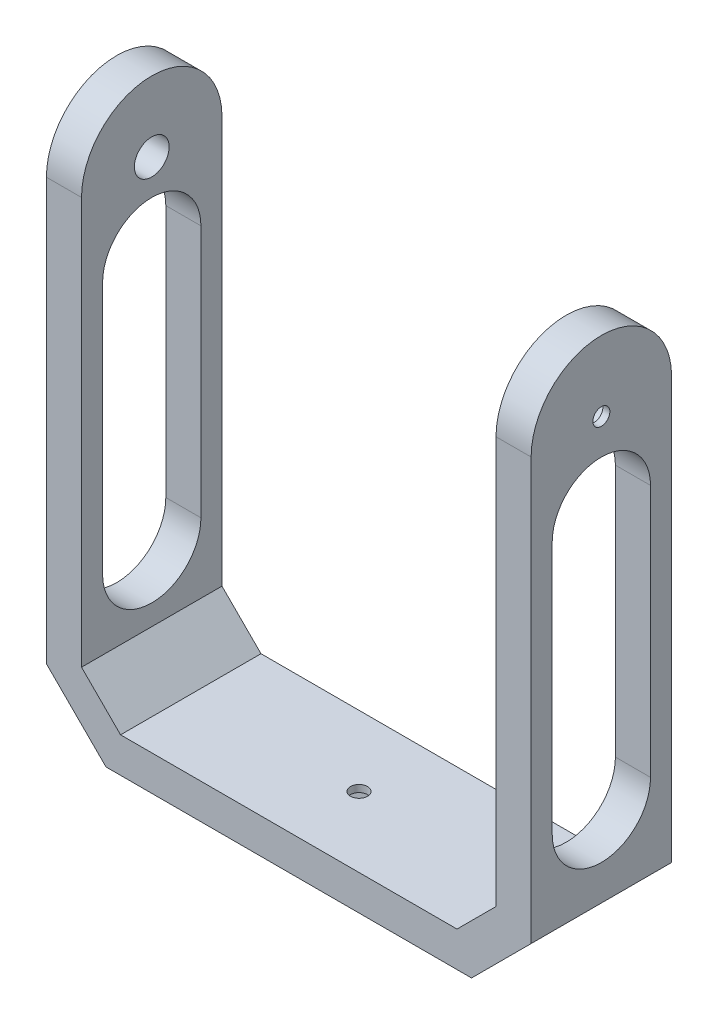
from build123d import *

# Parameters (mm, degrees)
BOSS_EXTRUDE1_DEPTH = 20
FILLET2_RADIUS      = 10
FILLET2_LENGTH      = 5
FILLET3_RADIUS      = 10
FILLET3_LENGTH      = 5
SKETCH2_W           = 36
SKETCH2_H           = 7.55
CUT_EXTRUDE1_DEPTH  = 3
CUT_EXTRUDE2_REACH  = 87.375
SKETCH4_R           = 1.21
SKETCH6_W           = 10
SKETCH6_H           = 7.55
CUT_EXTRUDE3_DEPTH  = 1
SKETCH7_R           = 2.45
CUT_EXTRUDE4_DEPTH  = 4
CUT_EXTRUDE5_REACH  = 105.925
SKETCH9_R           = 1.21
SKETCH10_R          = 2.475
CUT_EXTRUDE6_DEPTH  = 4
CUT_EXTRUDE7_DEPTH  = 105.582615121


with BuildPart() as part:
    # Sketch1 → Boss-Extrude1 (new body)
    with BuildSketch(Plane.XY):
        Polygon((-26.024718626, -2.5), (26.024718626, -2.5), (34.51, 5.985281374), (34.51, 75.985281374), (29.51, 75.985281374), (29.51, 8.056349186), (23.953650814, 2.5), (-23.953650814, 2.5), (-29.51, 8.056349186), (-29.51, 75.985281374), (-34.51, 75.985281374), (-34.51, 5.985281374), align=None)
    extrude(amount=BOSS_EXTRUDE1_DEPTH)

    # Fillet2: full round fillet: the end face becomes a half cylinder, R = half its width
    fillet2_face = Plane((-32.01, 75.985281374, 10), x_dir=(-1, 0, 0), z_dir=(0, 1, 0))  # on the end face: x along it, z out of the body
    fillet2_slab = fillet2_face.offset(-FILLET2_RADIUS / 2) * Box(FILLET2_LENGTH, 2 * FILLET2_RADIUS, FILLET2_RADIUS, mode=Mode.PRIVATE)  # the body's end, R deep
    fillet2_round = Plane((-32.01, 65.985281374, 10), x_dir=(0, 1, 0), z_dir=(-1, 0, 0)) * Cylinder(FILLET2_RADIUS, FILLET2_LENGTH, mode=Mode.PRIVATE)  # its axis R under the face
    add(fillet2_slab - fillet2_round, mode=Mode.SUBTRACT)

    # Fillet3: full round fillet: the end face becomes a half cylinder, R = half its width
    fillet3_face = Plane((32.01, 75.985281374, 10), x_dir=(1, 0, 0), z_dir=(0, 1, 0))  # on the end face: x along it, z out of the body
    fillet3_slab = fillet3_face.offset(-FILLET3_RADIUS / 2) * Box(FILLET3_LENGTH, 2 * FILLET3_RADIUS, FILLET3_RADIUS, mode=Mode.PRIVATE)  # the body's end, R deep
    fillet3_round = Plane((32.01, 65.985281374, 10), x_dir=(0, 1, 0), z_dir=(1, 0, 0)) * Cylinder(FILLET3_RADIUS, FILLET3_LENGTH, mode=Mode.PRIVATE)  # its axis R under the face
    add(fillet3_slab - fillet3_round, mode=Mode.SUBTRACT)

    # Sketch2 → Cut-Extrude1 (cut)
    with BuildSketch(Plane.XZ.offset(2.5)):
        with Locations((0, 10)):
            Rectangle(SKETCH2_W, SKETCH2_H)
    extrude(amount=-CUT_EXTRUDE1_DEPTH, mode=Mode.SUBTRACT)

    # Sketch4 → Cut-Extrude2 (cut, up to next)
    with BuildSketch(Plane.XZ.offset(-0.5), mode=Mode.PRIVATE) as cut_extrude2_sk1:
        with Locations(Location((0, 10, 0), (0, 0, 270))):
            Circle(SKETCH4_R)
    cut_extrude2_tool1 = extrude(cut_extrude2_sk1.sketch, amount=-CUT_EXTRUDE2_REACH, mode=Mode.PRIVATE) & part.part
    add(cut_extrude2_tool1.solids().sort_by_distance((0, 0.5, 10))[0], mode=Mode.SUBTRACT)

    # Sketch6 → Cut-Extrude3 (cut)
    with BuildSketch(Plane.XZ.offset(-0.5)):
        with Locations((0, 10)):
            Rectangle(SKETCH6_W, SKETCH6_H)
    extrude(amount=-CUT_EXTRUDE3_DEPTH, mode=Mode.SUBTRACT)

    # Sketch7 → Cut-Extrude4 (cut)
    with BuildSketch(Plane.ZY.offset(-29.51)):
        with Locations(Location((10, 65.985281374, 0), (0, 0, 270))):
            Circle(SKETCH7_R)
    extrude(amount=-CUT_EXTRUDE4_DEPTH, mode=Mode.SUBTRACT)

    # Sketch9 → Cut-Extrude5 (cut, up to next)
    with BuildSketch(Plane.ZY.offset(-33.51), mode=Mode.PRIVATE) as cut_extrude5_sk1:
        with Locations((10, 65.985281374)):
            Circle(SKETCH9_R)
    cut_extrude5_tool1 = extrude(cut_extrude5_sk1.sketch, amount=-CUT_EXTRUDE5_REACH, mode=Mode.PRIVATE) & part.part
    add(cut_extrude5_tool1.solids().sort_by_distance((33.51, 65.985281, 10))[0], mode=Mode.SUBTRACT)

    # Sketch10 → Cut-Extrude6 (cut)
    with BuildSketch(Plane(origin=(-29.51, 0, 0), x_dir=(0, 0, -1), z_dir=(1, 0, 0))):
        with Locations(Location((-10, 65.985281374, 0), (0, 0, 90))):
            Circle(SKETCH10_R)
    extrude(amount=-CUT_EXTRUDE6_DEPTH, mode=Mode.SUBTRACT)

    # Sketch11 → Cut-Extrude7 (cut, through all)
    with BuildSketch(Plane(origin=(34.51, 0, 0), x_dir=(0, 0, -1), z_dir=(1, 0, 0))):
        with BuildLine():
            Line((-3, 53.985281374), (-3, 17.985281374))
            ThreePointArc((-3, 17.985281374), (-10, 10.985281374), (-17, 17.985281374))
            Line((-17, 17.985281374), (-17, 53.985281374))
            ThreePointArc((-17, 53.985281374), (-10, 60.985281374), (-3, 53.985281374))
        make_face()
    extrude(amount=-CUT_EXTRUDE7_DEPTH, mode=Mode.SUBTRACT)


solid = part.part
